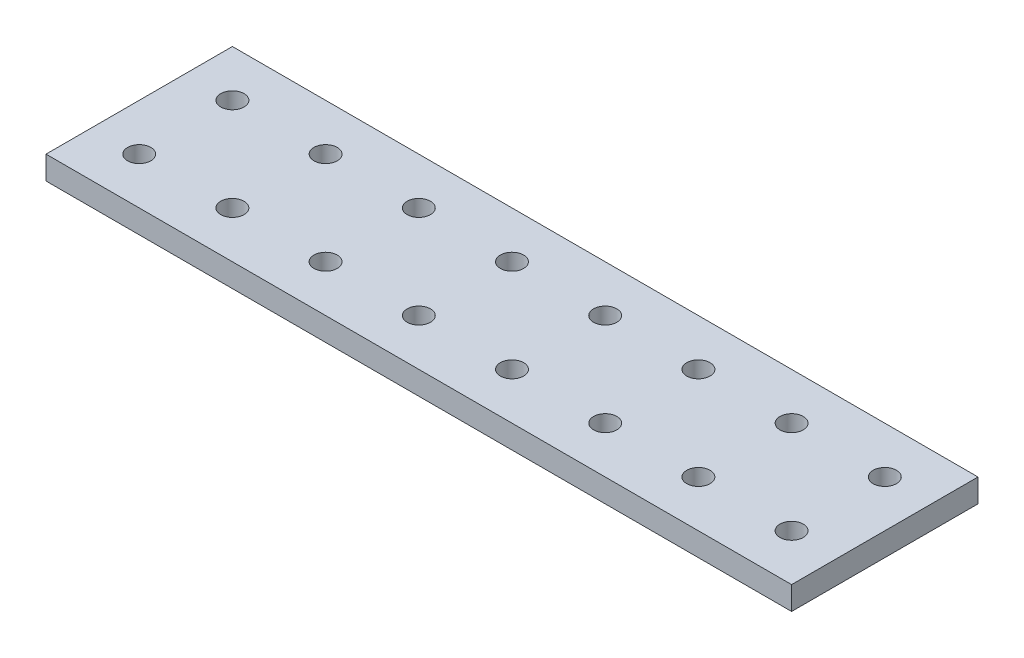
from build123d import *

# Parameters (mm, degrees)
SKETCH1_W           = 203.2
SKETCH1_H           = 50.8
SKETCH1_R           = 3.175
BOSS_EXTRUDE1_DEPTH = 6.35


with BuildPart() as part:
    # Sketch1 → Boss-Extrude1 (new body)
    with BuildSketch(Plane(origin=(0, 0, 0), x_dir=(1, 0, 0), z_dir=(0, 1, 0))):
        Rectangle(SKETCH1_W, SKETCH1_H)
        with Locations(Location((-88.9, 12.7, 0), (0, 0, 270))):
            Circle(SKETCH1_R, mode=Mode.SUBTRACT)
        with Locations(Location((-63.5, 12.7, 0), (0, 0, 270))):
            Circle(SKETCH1_R, mode=Mode.SUBTRACT)
        with Locations(Location((-38.1, 12.7, 0), (0, 0, 270))):
            Circle(SKETCH1_R, mode=Mode.SUBTRACT)
        with Locations(Location((-12.7, 12.7, 0), (0, 0, 270))):
            Circle(SKETCH1_R, mode=Mode.SUBTRACT)
        with Locations(Location((12.7, 12.7, 0), (0, 0, 270))):
            Circle(SKETCH1_R, mode=Mode.SUBTRACT)
        with Locations(Location((38.1, 12.7, 0), (0, 0, 270))):
            Circle(SKETCH1_R, mode=Mode.SUBTRACT)
        with Locations(Location((63.5, 12.7, 0), (0, 0, 270))):
            Circle(SKETCH1_R, mode=Mode.SUBTRACT)
        with Locations(Location((88.9, 12.7, 0), (0, 0, 270))):
            Circle(SKETCH1_R, mode=Mode.SUBTRACT)
        with Locations(Location((-63.5, -12.7, 0), (0, 0, 270))):
            Circle(SKETCH1_R, mode=Mode.SUBTRACT)
        with Locations(Location((-38.1, -12.7, 0), (0, 0, 270))):
            Circle(SKETCH1_R, mode=Mode.SUBTRACT)
        with Locations(Location((-12.7, -12.7, 0), (0, 0, 270))):
            Circle(SKETCH1_R, mode=Mode.SUBTRACT)
        with Locations(Location((12.7, -12.7, 0), (0, 0, 270))):
            Circle(SKETCH1_R, mode=Mode.SUBTRACT)
        with Locations(Location((38.1, -12.7, 0), (0, 0, 270))):
            Circle(SKETCH1_R, mode=Mode.SUBTRACT)
        with Locations(Location((63.5, -12.7, 0), (0, 0, 270))):
            Circle(SKETCH1_R, mode=Mode.SUBTRACT)
        with Locations(Location((88.9, -12.7, 0), (0, 0, 270))):
            Circle(SKETCH1_R, mode=Mode.SUBTRACT)
        with Locations(Location((-88.9, -12.7, 0), (0, 0, 270))):
            Circle(SKETCH1_R, mode=Mode.SUBTRACT)
    extrude(amount=BOSS_EXTRUDE1_DEPTH)


solid = part.part
